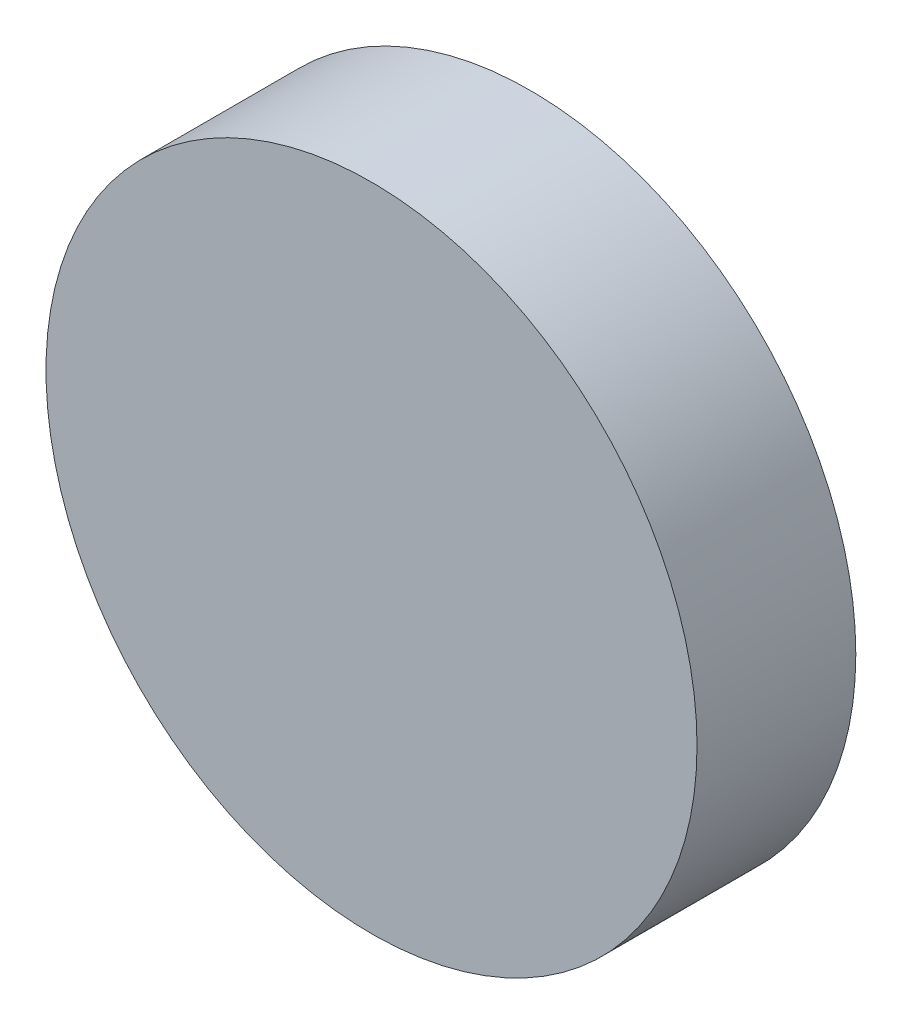
from build123d import *

# Parameters (mm, degrees)
SKETCH1_R           = 61.5
BOSS_EXTRUDE1_DEPTH = 15


with BuildPart() as part:
    # Sketch1 → Boss-Extrude1 (new, symmetric)
    with BuildSketch(Plane.XY):
        Circle(SKETCH1_R)
    extrude(amount=BOSS_EXTRUDE1_DEPTH, both=True)


solid = part.part
